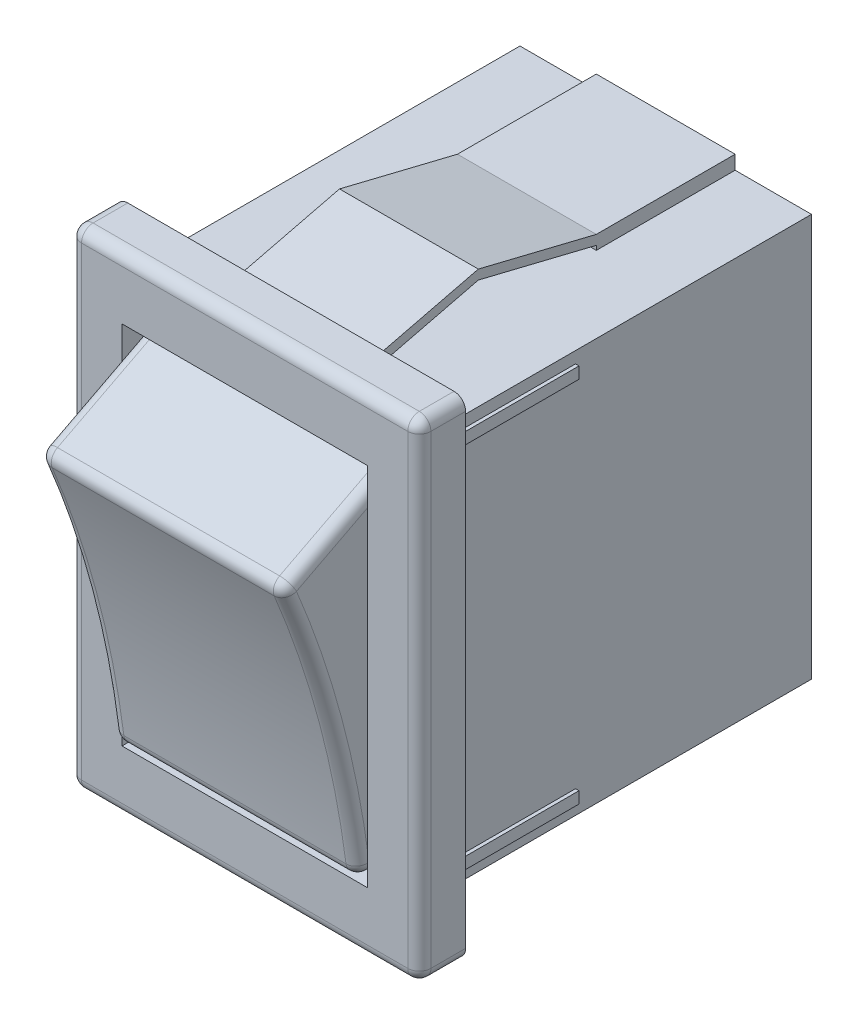
from build123d import *

# Parameters (mm, degrees)
SKETCH1_W           = 15.1
SKETCH1_H           = 21.1
SKETCH1_W_2         = 10.6
SKETCH1_H_2         = 15.8
BOSS_EXTRUDE1_DEPTH = 2
FILLET2_R           = 0.5
SKETCH2_W           = 12.6
SKETCH2_H           = 17.4
BOSS_EXTRUDE2_DEPTH = 16.2
SKETCH3_W           = 0.15
SKETCH3_H           = 0.5
BOSS_EXTRUDE3_DEPTH = 6
BOSS_EXTRUDE4_DEPTH = 3
BOSS_EXTRUDE5_DEPTH = 5.3
FILLET3_R           = 0.5


with BuildPart() as part:
    # Sketch1 → Boss-Extrude1 (new body)
    with BuildSketch(Plane.XY):
        Rectangle(SKETCH1_W, SKETCH1_H)
        Rectangle(SKETCH1_W_2, SKETCH1_H_2, mode=Mode.SUBTRACT)
    extrude(amount=BOSS_EXTRUDE1_DEPTH)

    # Fillet2
    fillet2_edges = [part.edges().sort_by_distance(p)[0] for p in [
        (-7.55, 0, 2),
        (0, -10.55, 2),
        (7.55, 0, 2),
        (7.55, -10.55, 1),
        (-7.55, -10.55, 1),
        (-7.55, 10.55, 1),
        (7.55, 10.55, 1),
        (0, 10.55, 2),
    ]]
    fillet(fillet2_edges, radius=FILLET2_R)

    # Sketch2 → Boss-Extrude2 (add)
    with BuildSketch(Plane(origin=(0, 0, 0), x_dir=(-1, 0, 0), z_dir=(0, 0, -1))):
        Rectangle(SKETCH2_W, SKETCH2_H)
    extrude(amount=BOSS_EXTRUDE2_DEPTH)

    # Sketch3 → Boss-Extrude3 (add)
    with BuildSketch(Plane(origin=(0, 0, 0), x_dir=(-1, 0, 0), z_dir=(0, 0, -1))):
        with Locations((-6.375, 7.95)):
            Rectangle(SKETCH3_W, SKETCH3_H)
        with Locations((6.375, 7.95)):
            Rectangle(SKETCH3_W, SKETCH3_H)
        with Locations((6.375, -7.95)):
            Rectangle(SKETCH3_W, SKETCH3_H)
        with Locations((-6.375, -7.95)):
            Rectangle(SKETCH3_W, SKETCH3_H)
    extrude(amount=BOSS_EXTRUDE3_DEPTH)

    # Sketch4 → Boss-Extrude4 (add, symmetric)
    with BuildSketch(Plane(origin=(0, 0, 0), x_dir=(0, 0, -1), z_dir=(1, 0, 0))):
        Polygon((16.2, 8.7), (16.2, 9.3), (10.2, 9.3), (5.1, 10.55), (0, 9.3), (0, 8.888160604), (5.1, 10.138160604), (10.2, 8.888160604), (10.2, 8.7), align=None)
        Polygon((10.2, -8.7), (16.2, -8.7), (16.2, -9.3), (10.2, -9.3), (5.1, -10.55), (0, -9.3), (0, -8.888160604), (5.1, -10.138160604), (10.2, -8.888160604), align=None)
    extrude(amount=BOSS_EXTRUDE4_DEPTH, both=True)


with BuildPart() as body_2:
    # Sketch5 → Boss-Extrude5 (new, symmetric)
    with BuildSketch(Plane(origin=(0, 0, 0), x_dir=(0, 0, -1), z_dir=(1, 0, 0))):
        with BuildLine():
            Line((-5.288985027, 5.162030775), (0, 7.9))
            Line((0, 7.9), (4.050480947, -7.21660069))
            Line((4.050480947, -7.21660069), (-1.898899059, -7.489942299))
            ThreePointArc((-1.898899059, -7.489942299), (-2.243321676, -7.373423646), (-2.417744006, -7.054393261))
            ThreePointArc((-2.417744006, -7.054393261), (-3.581800812, -1.160702529), (-5.520543412, 4.525411769))
            ThreePointArc((-5.520543412, 4.525411769), (-5.529004436, 4.888911353), (-5.288985027, 5.162030775))
        make_face()
    extrude(amount=BOSS_EXTRUDE5_DEPTH, both=True)

    # Fillet3
    fillet3_edges = [body_2.edges().sort_by_distance(p)[0] for p in [
        (5.3, 4.888911353, 5.529004436),
        (5.3, -1.160702529, 3.581800812),
        (5.3, -7.373423646, 2.243321676),
        (5.3, -7.353271495, -1.075790944),
        (-5.3, -7.353271495, -1.075790944),
        (-5.3, -7.373423646, 2.243321676),
        (-5.3, -1.160702529, 3.581800812),
        (-5.3, 4.888911353, 5.529004436),
        (-5.3, 6.531015387, 2.644492513),
        (5.3, 6.531015387, 2.644492513),
    ]]
    fillet(fillet3_edges, radius=FILLET3_R)


solid = Compound([part.part, body_2.part])
